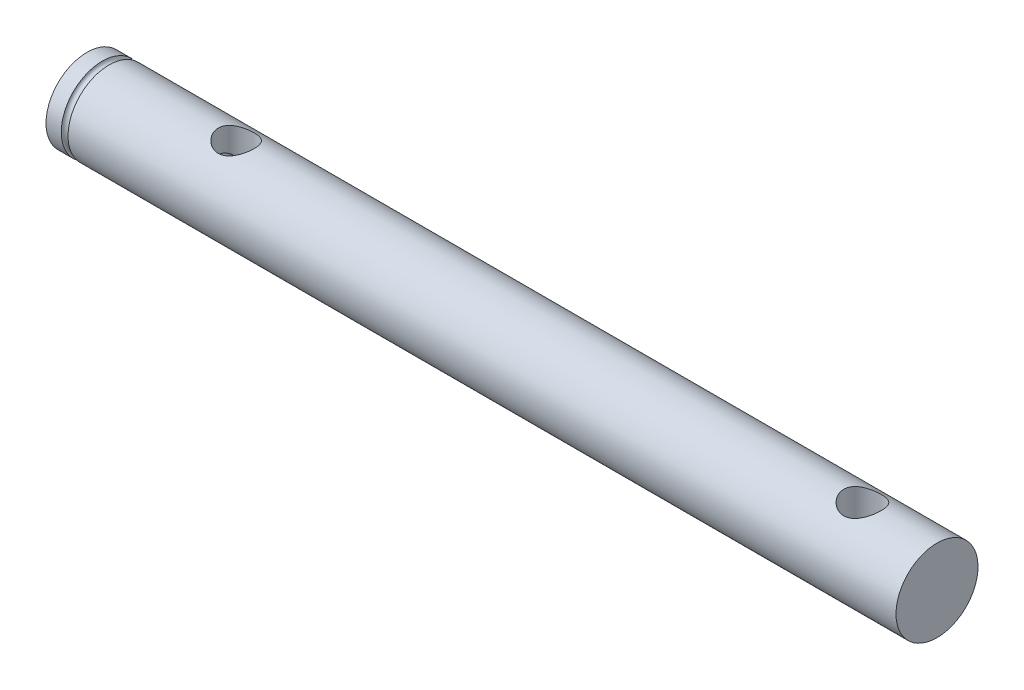
from build123d import *
from build123d.topology import SkipClean

# Parameters (mm, degrees)
ESBO_O9_W                  = 4
ESBO_O9_H                  = 15
CORTE_EXTRUS_O5_DEPTH      = 229.530085547
ESBO_O10_W                 = 3
ESBO_O10_H                 = 11
CORTE_EXTRUS_O6_DEPTH      = 229.530085556
CORTE_EXTRUS_O7_DEPTH      = 229.530085556
CORTE_EXTRUS_O7_DEPTH_BACK = 4.8
ESBO_O12_R                 = 4.8
ESBO_O16_R                 = 0.9
CORTE_EXTRUS_O10_DEPTH     = 229.530085656
ESBO_O17_R                 = 5
CORTE_EXTRUS_O11_DEPTH     = 11


with BuildPart() as part:
    # Esboço1 → Revolução1 (revolve)
    with BuildSketch(Plane.XY, mode=Mode.PRIVATE) as revolu_o1_sk:
        with BuildLine():
            Line((40, 0), (228, 0))
            Line((228, 0), (228, 11))
            Line((228, 11), (5.9, 11))
            ThreePointArc((5.9, 11), (5, 10.1), (4.1, 11))
            Line((4.1, 11), (0, 11))
            Line((0, 11), (0, 5.5))
            Line((0, 5.5), (3, 5.5))
            Line((3, 5.5), (3, 7.5))
            Line((3, 7.5), (7, 7.5))
            Line((7, 7.5), (7, 4.8))
            Line((7, 4.8), (40, 4.8))
            Line((40, 4.8), (40, 0))
        make_face()
    revolve(revolu_o1_sk.sketch.rotate(Axis((40, 0, 0), (1, 0, 0)), 180), axis=Axis((40, 0, 0), (1, 0, 0)))

    # Esboço9 → Corte-extrusão5 (cut, through all)
    with BuildSketch(Plane.XY):
        with Locations((5, 0)):
            Rectangle(ESBO_O9_W, ESBO_O9_H)
    extrude(amount=-CORTE_EXTRUS_O5_DEPTH, mode=Mode.SUBTRACT)

    # Esboço10 → Corte-extrusão6 (cut, through all)
    with BuildSketch(Plane.XY):
        with Locations((1.5, 0)):
            Rectangle(ESBO_O10_W, ESBO_O10_H)
    extrude(amount=-CORTE_EXTRUS_O6_DEPTH, mode=Mode.SUBTRACT)

    # Esboço12 → Corte-extrusão7 (cut, two sides: drawn at the far end of the back side and taken through both)
    with SkipClean():  # the faces are left unmerged after this step: merging them gives an invalid solid
        with BuildSketch(Plane(origin=(0, 0, 0), x_dir=(1, 0, 0), z_dir=(0, 1, 0)).offset(-CORTE_EXTRUS_O7_DEPTH_BACK)):
            with Locations(Location((40, 0, 0), (0, 0, 270))):
                Circle(ESBO_O12_R)
        extrude(amount=CORTE_EXTRUS_O7_DEPTH + CORTE_EXTRUS_O7_DEPTH_BACK, mode=Mode.SUBTRACT)

    # Esboço16 → Corte-extrusão10 (cut, through all)
    with SkipClean():  # the faces are left unmerged after this step: merging them gives an invalid solid
        with BuildSketch(Plane(origin=(0, 0, 0), x_dir=(1, 0, 0), z_dir=(0, 1, 0))):
            with Locations((5, 5)):
                Circle(ESBO_O16_R)
        extrude(amount=-CORTE_EXTRUS_O10_DEPTH, mode=Mode.SUBTRACT)

    # Esboço17 → Corte-extrusão11 (cut, symmetric)
    with SkipClean():  # the faces are left unmerged after this step: merging them gives an invalid solid
        with BuildSketch(Plane(origin=(0, 0, 0), x_dir=(1, 0, 0), z_dir=(0, 1, 0))):
            with Locations(Location((208, 0, 0), (0, 0, 270))):
                Circle(ESBO_O17_R)
        extrude(amount=CORTE_EXTRUS_O11_DEPTH, both=True, mode=Mode.SUBTRACT)


solid = part.part
